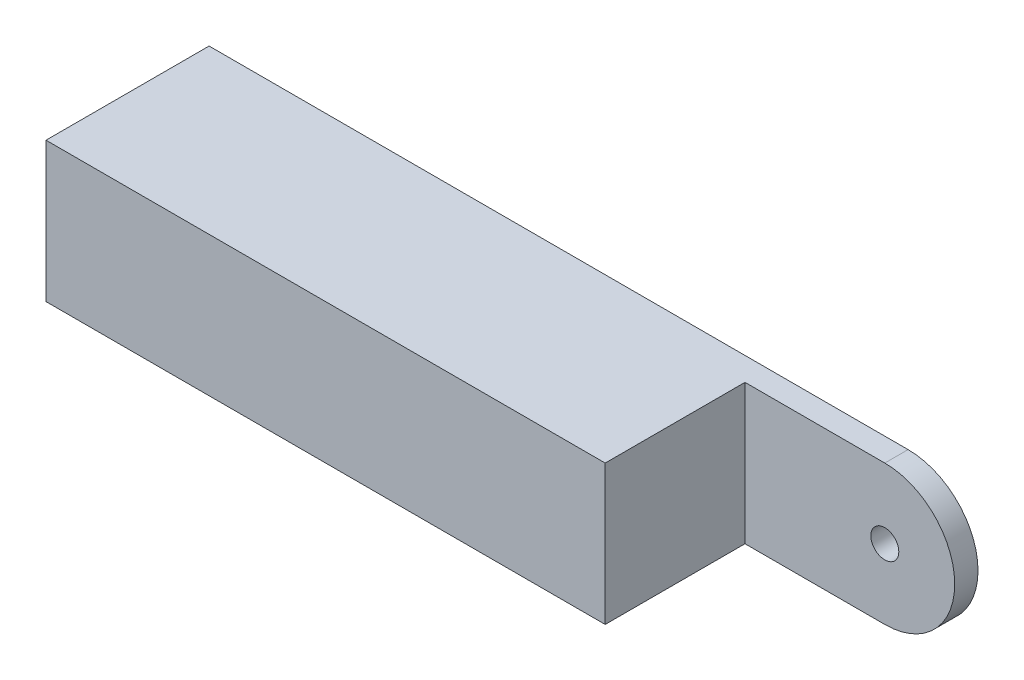
from build123d import *

# Parameters (mm, degrees)
SKETCH_1_W          = 120
SKETCH_1_H          = 30
EXTRUDE_2_DEPTH     = 35
SKETCH_1_8_R        = 3
EXTRUDE_3_DEPTH     = 5
SKETCH_2_W          = 40
SKETCH_2_H          = 19.883815918
CUT_EXTRUDE_1_DEPTH = 30


with BuildPart() as part:
    # 草图1 → 凸台-拉伸2 (new body)
    with BuildSketch(Plane.XY):
        Rectangle(SKETCH_1_W, SKETCH_1_H)
    extrude(amount=EXTRUDE_2_DEPTH)

    # 草图1<8> → 凸台-拉伸3 (add)
    with BuildSketch(Plane.XY):
        with BuildLine():
            Line((90, 15), (60, 15))
            Line((60, 15), (60, -15))
            Line((60, -15), (90, -15))
            ThreePointArc((90, -15), (105, 0), (90, 15))
        make_face()
        with Locations((90, 0)):
            Circle(SKETCH_1_8_R, mode=Mode.SUBTRACT)
    extrude(amount=EXTRUDE_3_DEPTH)

    # 草图2 → 切除-拉伸1 (cut)
    with BuildSketch(Plane(origin=(0, 0, 0), x_dir=(-1, 0, 0), z_dir=(0, 0, -1))):
        with Locations((30, 0.058092041)):
            Rectangle(SKETCH_2_W, SKETCH_2_H)
    extrude(amount=-CUT_EXTRUDE_1_DEPTH, mode=Mode.SUBTRACT)


solid = part.part
